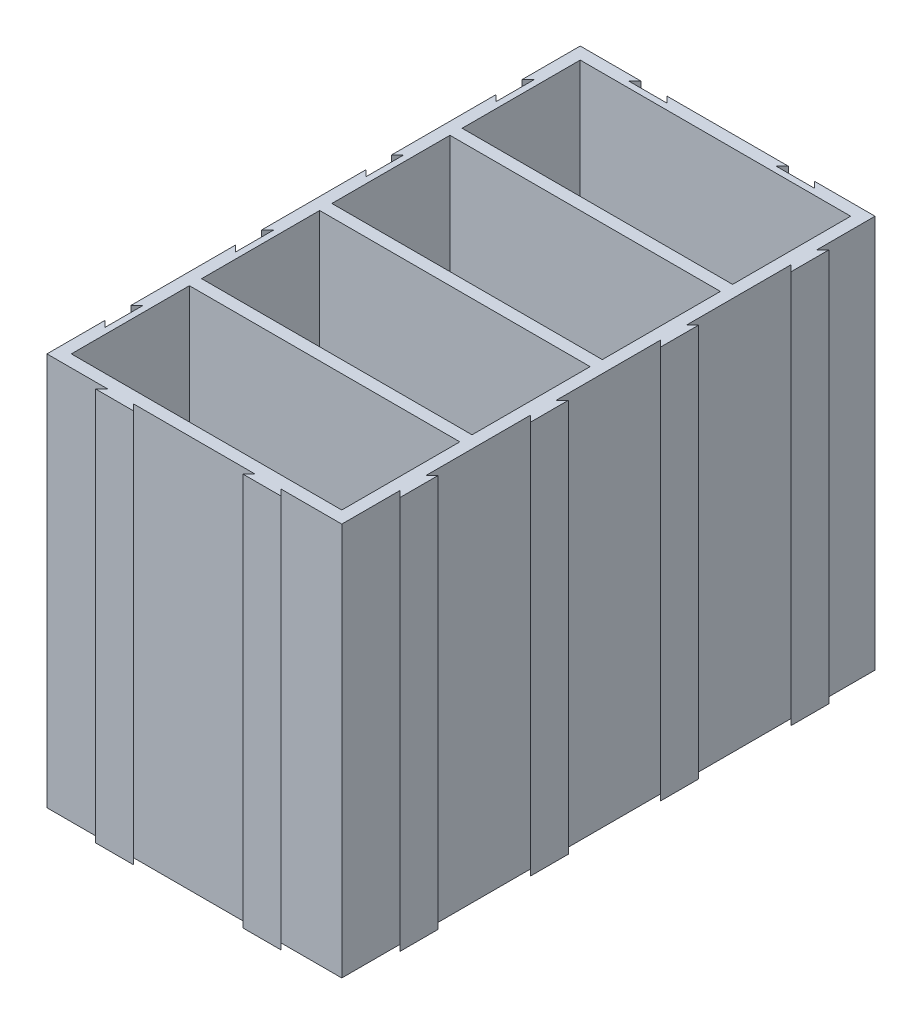
from build123d import *

# Parameters (mm, degrees)
EXTRUDE_1_DEPTH = 1.6
EXTRUDE_START   = 1.6
EXTRUDE_2_DEPTH = 50


with BuildPart() as part:
    # Эскиз1 → Бобышка-Вытянуть1 (new body)
    with BuildSketch(Plane(origin=(0, 0, 0), x_dir=(1, 0, 0), z_dir=(0, 1, 0))):
        Polygon((-19.35, 35), (-19.35, 27.35), (-18.55, 28.15), (-18.55, 23.15), (-19.35, 23.95), (-19.35, 10.25), (-18.55, 11.05), (-18.55, 6.05), (-19.35, 6.85), (-19.35, -6.85), (-18.55, -6.05), (-18.55, -11.05), (-19.35, -10.25), (-19.35, -23.95), (-18.55, -23.15), (-18.55, -28.15), (-19.35, -27.35), (-19.35, -35), (-11.375, -35), (-12.175, -35.8), (-7.175, -35.8), (-7.975, -35), (7.975, -35), (7.175, -35.8), (12.175, -35.8), (11.375, -35), (19.35, -35), (19.35, -27.35), (20.15, -28.15), (20.15, -23.15), (19.35, -23.95), (19.35, -10.25), (20.15, -11.05), (20.15, -6.05), (19.35, -6.85), (19.35, 6.85), (20.15, 6.05), (20.15, 11.05), (19.35, 10.25), (19.35, 23.95), (20.15, 23.15), (20.15, 28.15), (19.35, 27.35), (19.35, 35), (11.375, 35), (12.175, 34.2), (7.175, 34.2), (7.975, 35), (-7.975, 35), (-7.175, 34.2), (-12.175, 34.2), (-11.375, 35), align=None)
        with BuildLine():
            ThreePointArc((-16.75, 0.8), (-17.457106781, 1.092893219), (-17.75, 1.8))
            Line((-17.75, 1.8), (-17.75, 5.05))
            ThreePointArc((-17.75, 5.05), (-17.457106781, 5.757106781), (-16.75, 6.05))
            Line((-16.75, 6.05), (-3.5, 6.05))
            ThreePointArc((-3.5, 6.05), (-2.792893219, 5.757106781), (-2.5, 5.05))
            Line((-2.5, 5.05), (-2.5, 1.8))
            ThreePointArc((-2.5, 1.8), (-2.792893219, 1.092893219), (-3.5, 0.8))
            Line((-3.5, 0.8), (-16.75, 0.8))
        make_face(mode=Mode.SUBTRACT)
        with BuildLine():
            Line((-3.5, -33.4), (-16.75, -33.4))
            ThreePointArc((-16.75, -33.4), (-17.457106781, -33.107106781), (-17.75, -32.4))
            Line((-17.75, -32.4), (-17.75, -29.15))
            ThreePointArc((-17.75, -29.15), (-17.457106781, -28.442893219), (-16.75, -28.15))
            Line((-16.75, -28.15), (-3.5, -28.15))
            ThreePointArc((-3.5, -28.15), (-2.792893219, -28.442893219), (-2.5, -29.15))
            Line((-2.5, -29.15), (-2.5, -32.4))
            ThreePointArc((-2.5, -32.4), (-2.792893219, -33.107106781), (-3.5, -33.4))
        make_face(mode=Mode.SUBTRACT)
        with BuildLine():
            Line((16.75, -33.4), (3.5, -33.4))
            ThreePointArc((3.5, -33.4), (2.792893219, -33.107106781), (2.5, -32.4))
            Line((2.5, -32.4), (2.5, -29.15))
            ThreePointArc((2.5, -29.15), (2.792893219, -28.442893219), (3.5, -28.15))
            Line((3.5, -28.15), (16.75, -28.15))
            ThreePointArc((16.75, -28.15), (17.457106781, -28.442893219), (17.75, -29.15))
            Line((17.75, -29.15), (17.75, -32.4))
            ThreePointArc((17.75, -32.4), (17.457106781, -33.107106781), (16.75, -33.4))
        make_face(mode=Mode.SUBTRACT)
        with BuildLine():
            Line((17.75, -18.9), (17.75, -22.15))
            ThreePointArc((17.75, -22.15), (17.457106781, -22.857106781), (16.75, -23.15))
            Line((16.75, -23.15), (3.5, -23.15))
            ThreePointArc((3.5, -23.15), (2.792893219, -22.857106781), (2.5, -22.15))
            Line((2.5, -22.15), (2.5, -18.9))
            ThreePointArc((2.5, -18.9), (2.792893219, -18.192893219), (3.5, -17.9))
            Line((3.5, -17.9), (16.75, -17.9))
            ThreePointArc((16.75, -17.9), (17.457106781, -18.192893219), (17.75, -18.9))
        make_face(mode=Mode.SUBTRACT)
        with BuildLine():
            Line((-16.75, -17.9), (-3.5, -17.9))
            ThreePointArc((-3.5, -17.9), (-2.792893219, -18.192893219), (-2.5, -18.9))
            Line((-2.5, -18.9), (-2.5, -22.15))
            ThreePointArc((-2.5, -22.15), (-2.792893219, -22.857106781), (-3.5, -23.15))
            Line((-3.5, -23.15), (-16.75, -23.15))
            ThreePointArc((-16.75, -23.15), (-17.457106781, -22.857106781), (-17.75, -22.15))
            Line((-17.75, -22.15), (-17.75, -18.9))
            ThreePointArc((-17.75, -18.9), (-17.457106781, -18.192893219), (-16.75, -17.9))
        make_face(mode=Mode.SUBTRACT)
        with BuildLine():
            Line((-3.5, -16.3), (-16.75, -16.3))
            ThreePointArc((-16.75, -16.3), (-17.457106781, -16.007106781), (-17.75, -15.3))
            Line((-17.75, -15.3), (-17.75, -12.05))
            ThreePointArc((-17.75, -12.05), (-17.457106781, -11.342893219), (-16.75, -11.05))
            Line((-16.75, -11.05), (-3.5, -11.05))
            ThreePointArc((-3.5, -11.05), (-2.792893219, -11.342893219), (-2.5, -12.05))
            Line((-2.5, -12.05), (-2.5, -15.3))
            ThreePointArc((-2.5, -15.3), (-2.792893219, -16.007106781), (-3.5, -16.3))
        make_face(mode=Mode.SUBTRACT)
        with BuildLine():
            Line((16.75, -16.3), (3.5, -16.3))
            ThreePointArc((3.5, -16.3), (2.792893219, -16.007106781), (2.5, -15.3))
            Line((2.5, -15.3), (2.5, -12.05))
            ThreePointArc((2.5, -12.05), (2.792893219, -11.342893219), (3.5, -11.05))
            Line((3.5, -11.05), (16.75, -11.05))
            ThreePointArc((16.75, -11.05), (17.457106781, -11.342893219), (17.75, -12.05))
            Line((17.75, -12.05), (17.75, -15.3))
            ThreePointArc((17.75, -15.3), (17.457106781, -16.007106781), (16.75, -16.3))
        make_face(mode=Mode.SUBTRACT)
        with BuildLine():
            Line((17.75, -1.8), (17.75, -5.05))
            ThreePointArc((17.75, -5.05), (17.457106781, -5.757106781), (16.75, -6.05))
            Line((16.75, -6.05), (3.5, -6.05))
            ThreePointArc((3.5, -6.05), (2.792893219, -5.757106781), (2.5, -5.05))
            Line((2.5, -5.05), (2.5, -1.8))
            ThreePointArc((2.5, -1.8), (2.792893219, -1.092893219), (3.5, -0.8))
            Line((3.5, -0.8), (16.75, -0.8))
            ThreePointArc((16.75, -0.8), (17.457106781, -1.092893219), (17.75, -1.8))
        make_face(mode=Mode.SUBTRACT)
        with BuildLine():
            Line((-16.75, -0.8), (-3.5, -0.8))
            ThreePointArc((-3.5, -0.8), (-2.792893219, -1.092893219), (-2.5, -1.8))
            Line((-2.5, -1.8), (-2.5, -5.05))
            ThreePointArc((-2.5, -5.05), (-2.792893219, -5.757106781), (-3.5, -6.05))
            Line((-3.5, -6.05), (-16.75, -6.05))
            ThreePointArc((-16.75, -6.05), (-17.457106781, -5.757106781), (-17.75, -5.05))
            Line((-17.75, -5.05), (-17.75, -1.8))
            ThreePointArc((-17.75, -1.8), (-17.457106781, -1.092893219), (-16.75, -0.8))
        make_face(mode=Mode.SUBTRACT)
        with BuildLine():
            Line((-17.75, 18.9), (-17.75, 22.15))
            ThreePointArc((-17.75, 22.15), (-17.457106781, 22.857106781), (-16.75, 23.15))
            Line((-16.75, 23.15), (-3.5, 23.15))
            ThreePointArc((-3.5, 23.15), (-2.792893219, 22.857106781), (-2.5, 22.15))
            Line((-2.5, 22.15), (-2.5, 18.9))
            ThreePointArc((-2.5, 18.9), (-2.792893219, 18.192893219), (-3.5, 17.9))
            Line((-3.5, 17.9), (-16.75, 17.9))
            ThreePointArc((-16.75, 17.9), (-17.457106781, 18.192893219), (-17.75, 18.9))
        make_face(mode=Mode.SUBTRACT)
        with BuildLine():
            Line((16.75, 0.8), (3.5, 0.8))
            ThreePointArc((3.5, 0.8), (2.792893219, 1.092893219), (2.5, 1.8))
            Line((2.5, 1.8), (2.5, 5.05))
            ThreePointArc((2.5, 5.05), (2.792893219, 5.757106781), (3.5, 6.05))
            Line((3.5, 6.05), (16.75, 6.05))
            ThreePointArc((16.75, 6.05), (17.457106781, 5.757106781), (17.75, 5.05))
            Line((17.75, 5.05), (17.75, 1.8))
            ThreePointArc((17.75, 1.8), (17.457106781, 1.092893219), (16.75, 0.8))
        make_face(mode=Mode.SUBTRACT)
        with BuildLine():
            Line((17.75, 15.3), (17.75, 12.05))
            ThreePointArc((17.75, 12.05), (17.457106781, 11.342893219), (16.75, 11.05))
            Line((16.75, 11.05), (3.5, 11.05))
            ThreePointArc((3.5, 11.05), (2.792893219, 11.342893219), (2.5, 12.05))
            Line((2.5, 12.05), (2.5, 15.3))
            ThreePointArc((2.5, 15.3), (2.792893219, 16.007106781), (3.5, 16.3))
            Line((3.5, 16.3), (16.75, 16.3))
            ThreePointArc((16.75, 16.3), (17.457106781, 16.007106781), (17.75, 15.3))
        make_face(mode=Mode.SUBTRACT)
        with BuildLine():
            Line((-16.75, 16.3), (-3.5, 16.3))
            ThreePointArc((-3.5, 16.3), (-2.792893219, 16.007106781), (-2.5, 15.3))
            Line((-2.5, 15.3), (-2.5, 12.05))
            ThreePointArc((-2.5, 12.05), (-2.792893219, 11.342893219), (-3.5, 11.05))
            Line((-3.5, 11.05), (-16.75, 11.05))
            ThreePointArc((-16.75, 11.05), (-17.457106781, 11.342893219), (-17.75, 12.05))
            Line((-17.75, 12.05), (-17.75, 15.3))
            ThreePointArc((-17.75, 15.3), (-17.457106781, 16.007106781), (-16.75, 16.3))
        make_face(mode=Mode.SUBTRACT)
        with BuildLine():
            Line((16.75, 17.9), (3.5, 17.9))
            ThreePointArc((3.5, 17.9), (2.792893219, 18.192893219), (2.5, 18.9))
            Line((2.5, 18.9), (2.5, 22.15))
            ThreePointArc((2.5, 22.15), (2.792893219, 22.857106781), (3.5, 23.15))
            Line((3.5, 23.15), (16.75, 23.15))
            ThreePointArc((16.75, 23.15), (17.457106781, 22.857106781), (17.75, 22.15))
            Line((17.75, 22.15), (17.75, 18.9))
            ThreePointArc((17.75, 18.9), (17.457106781, 18.192893219), (16.75, 17.9))
        make_face(mode=Mode.SUBTRACT)
        with BuildLine():
            Line((17.75, 32.4), (17.75, 29.15))
            ThreePointArc((17.75, 29.15), (17.457106781, 28.442893219), (16.75, 28.15))
            Line((16.75, 28.15), (3.5, 28.15))
            ThreePointArc((3.5, 28.15), (2.792893219, 28.442893219), (2.5, 29.15))
            Line((2.5, 29.15), (2.5, 32.4))
            ThreePointArc((2.5, 32.4), (2.792893219, 33.107106781), (3.5, 33.4))
            Line((3.5, 33.4), (16.75, 33.4))
            ThreePointArc((16.75, 33.4), (17.457106781, 33.107106781), (17.75, 32.4))
        make_face(mode=Mode.SUBTRACT)
        with BuildLine():
            Line((-16.75, 33.4), (-3.5, 33.4))
            ThreePointArc((-3.5, 33.4), (-2.792893219, 33.107106781), (-2.5, 32.4))
            Line((-2.5, 32.4), (-2.5, 29.15))
            ThreePointArc((-2.5, 29.15), (-2.792893219, 28.442893219), (-3.5, 28.15))
            Line((-3.5, 28.15), (-16.75, 28.15))
            ThreePointArc((-16.75, 28.15), (-17.457106781, 28.442893219), (-17.75, 29.15))
            Line((-17.75, 29.15), (-17.75, 32.4))
            ThreePointArc((-17.75, 32.4), (-17.457106781, 33.107106781), (-16.75, 33.4))
        make_face(mode=Mode.SUBTRACT)
    extrude(amount=EXTRUDE_1_DEPTH)

    # Эскиз1<3> → Бобышка-Вытянуть2 (add)
    with BuildSketch(Plane(origin=(0, 0, 0), x_dir=(1, 0, 0), z_dir=(0, 1, 0)).offset(EXTRUDE_START)):
        Polygon((-19.35, 35), (-19.35, 27.35), (-18.55, 28.15), (-18.55, 23.15), (-19.35, 23.95), (-19.35, 10.25), (-18.55, 11.05), (-18.55, 6.05), (-19.35, 6.85), (-19.35, -6.85), (-18.55, -6.05), (-18.55, -11.05), (-19.35, -10.25), (-19.35, -23.95), (-18.55, -23.15), (-18.55, -28.15), (-19.35, -27.35), (-19.35, -35), (-11.375, -35), (-12.175, -35.8), (-7.175, -35.8), (-7.975, -35), (7.975, -35), (7.175, -35.8), (12.175, -35.8), (11.375, -35), (19.35, -35), (19.35, -27.35), (20.15, -28.15), (20.15, -23.15), (19.35, -23.95), (19.35, -10.25), (20.15, -11.05), (20.15, -6.05), (19.35, -6.85), (19.35, 6.85), (20.15, 6.05), (20.15, 11.05), (19.35, 10.25), (19.35, 23.95), (20.15, 23.15), (20.15, 28.15), (19.35, 27.35), (19.35, 35), (11.375, 35), (12.175, 34.2), (7.175, 34.2), (7.975, 35), (-7.975, 35), (-7.175, 34.2), (-12.175, 34.2), (-11.375, 35), align=None)
        Polygon((-16.75, -33.4), (-17.75, -33.4), (-17.75, -32.4), (-17.75, -29.15), (-17.75, -22.15), (-17.75, -18.9), (-17.75, -17.9), (-16.75, -17.9), (-3.5, -17.9), (3.5, -17.9), (16.75, -17.9), (17.75, -17.9), (17.75, -18.9), (17.75, -22.15), (17.75, -29.15), (17.75, -32.4), (17.75, -33.4), (16.75, -33.4), (3.5, -33.4), (-3.5, -33.4), align=None, mode=Mode.SUBTRACT)
        Polygon((-16.75, -16.3), (-17.75, -16.3), (-17.75, -15.3), (-17.75, -12.05), (-17.75, -5.05), (-17.75, -1.8), (-17.75, -0.8), (-16.75, -0.8), (-3.5, -0.8), (3.5, -0.8), (16.75, -0.8), (17.75, -0.8), (17.75, -1.8), (17.75, -5.05), (17.75, -12.05), (17.75, -15.3), (17.75, -16.3), (16.75, -16.3), (3.5, -16.3), (-3.5, -16.3), align=None, mode=Mode.SUBTRACT)
        Polygon((-16.75, 0.8), (-17.75, 0.8), (-17.75, 1.8), (-17.75, 5.05), (-17.75, 12.05), (-17.75, 15.3), (-17.75, 16.3), (-16.75, 16.3), (-3.5, 16.3), (3.5, 16.3), (16.75, 16.3), (17.75, 16.3), (17.75, 15.3), (17.75, 12.05), (17.75, 5.05), (17.75, 1.8), (17.75, 0.8), (16.75, 0.8), (3.5, 0.8), (-3.5, 0.8), align=None, mode=Mode.SUBTRACT)
        Polygon((-16.75, 17.9), (-17.75, 17.9), (-17.75, 18.9), (-17.75, 22.15), (-17.75, 29.15), (-17.75, 32.4), (-17.75, 33.4), (-16.75, 33.4), (-3.5, 33.4), (3.5, 33.4), (16.75, 33.4), (17.75, 33.4), (17.75, 32.4), (17.75, 29.15), (17.75, 22.15), (17.75, 18.9), (17.75, 17.9), (16.75, 17.9), (3.5, 17.9), (-3.5, 17.9), align=None, mode=Mode.SUBTRACT)
    extrude(amount=EXTRUDE_2_DEPTH)


solid = part.part
